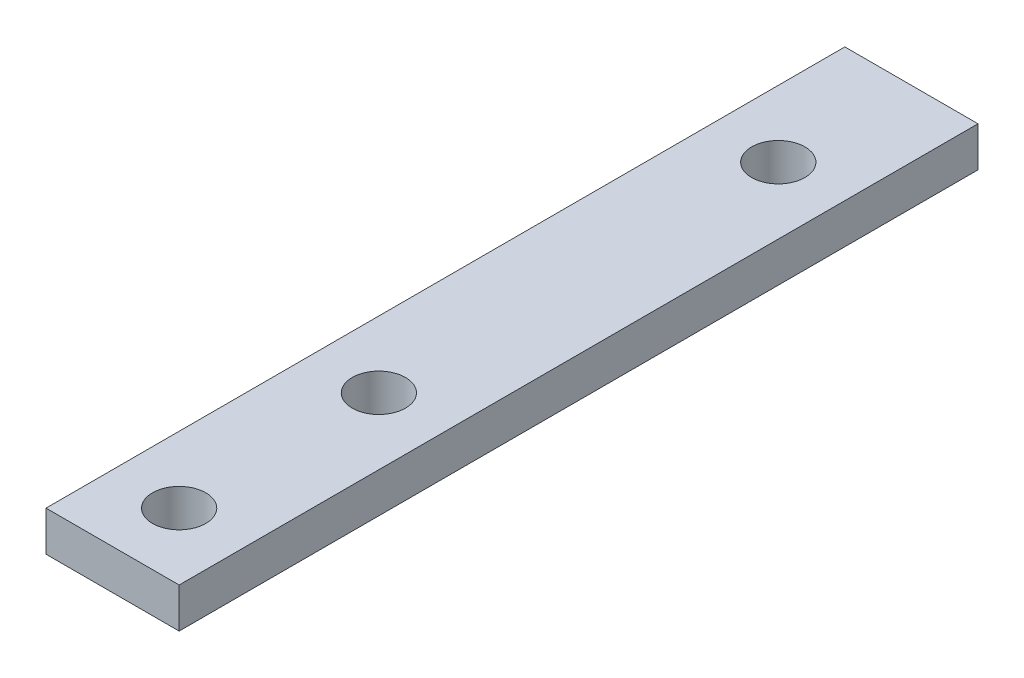
from build123d import *

# Parameters (mm, degrees)
SKETCH1_R           = 2
BOSS_EXTRUDE1_DEPTH = 3


with BuildPart() as part:
    # Sketch1 → Boss-Extrude1 (new body)
    with BuildSketch(Plane(origin=(0, 0, 0), x_dir=(1, 0, 0), z_dir=(0, 1, 0))):
        Polygon((0, 0), (-5, 0), (-5, 60), (5, 60), (5, 0), align=None)
        with Locations(Location((0, 20, 0), (0, 0, 270))):
            Circle(SKETCH1_R, mode=Mode.SUBTRACT)
        with Locations(Location((0, 5, 0), (0, 0, 270))):
            Circle(SKETCH1_R, mode=Mode.SUBTRACT)
        with Locations(Location((0, 50, 0), (0, 0, 270))):
            Circle(SKETCH1_R, mode=Mode.SUBTRACT)
    extrude(amount=BOSS_EXTRUDE1_DEPTH)


solid = part.part
